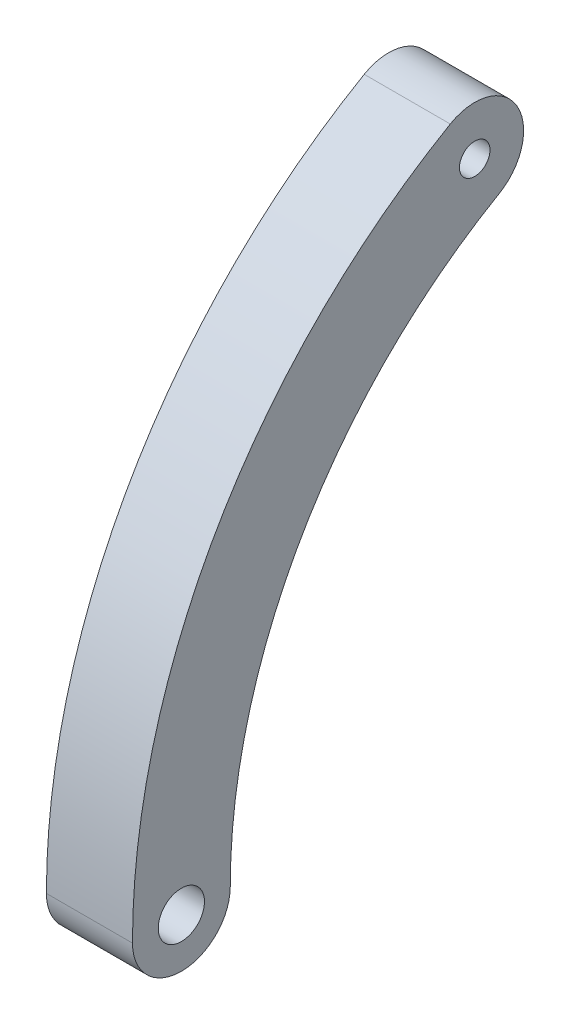
from build123d import *

# Parameters (mm, degrees)
ESQUISSE1_R        = 1.5
ESQUISSE1_R_2      = 0.9921875
BOSS_EXTRU_1_DEPTH = 5.588


with BuildPart() as part:
    # Esquisse1 → Boss.-Extru.1 (new body)
    with BuildSketch(Plane(origin=(0, 0, 0), x_dir=(0, 0, -1), z_dir=(1, 0, 0))):
        with BuildLine():
            ThreePointArc((-34.925, 0), (-30.245937227, 17.4625), (-17.4625, 30.245937227))
            ThreePointArc((-17.4625, 30.245937227), (-16.300369343, 34.583067884), (-20.6375, 35.745198541))
            ThreePointArc((-20.6375, 35.745198541), (-35.745198541, 20.6375), (-41.275, 0))
            ThreePointArc((-41.275, 0), (-38.1, -3.175), (-34.925, 0))
        make_face()
        with Locations((-38.1, 0)):
            Circle(ESQUISSE1_R, mode=Mode.SUBTRACT)
        with Locations((-19.05, 32.995567884)):
            Circle(ESQUISSE1_R_2, mode=Mode.SUBTRACT)
    extrude(amount=BOSS_EXTRU_1_DEPTH)


solid = part.part
